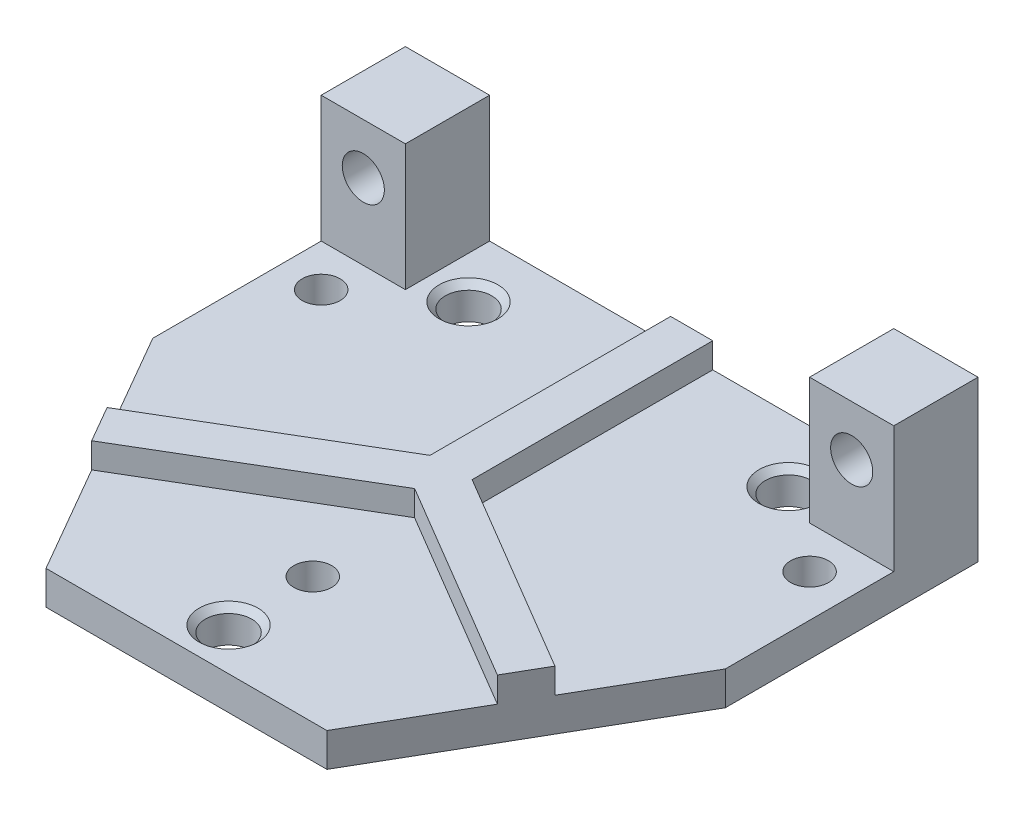
from build123d import *

# Parameters (mm, degrees)
SKETCH1_R           = 2.75
SKETCH1_R_2         = 2.25
BOSS_EXTRUDE1_DEPTH = 4
BOSS_EXTRUDE2_DEPTH = 3
SKETCH3_W           = 10
SKETCH3_H           = 10
BOSS_EXTRUDE3_DEPTH = 15
SKETCH4_R           = 2.5
CUT_EXTRUDE1_DEPTH  = 72.533209071
CHAMFER1_SIZE       = 0.75


with BuildPart() as part:
    # Sketch1 → Boss-Extrude1 (new body)
    with BuildSketch(Plane(origin=(0, 0, 0), x_dir=(1, 0, 0), z_dir=(0, 1, 0))):
        Polygon((-16.679491924, -30), (16.679491924, -30), (34, 0), (34, 30), (-34, 30), (-34, 0), align=None)
        with Locations(Location((-19, 22.5, 0), (0, 0, 270))):
            Circle(SKETCH1_R, mode=Mode.SUBTRACT)
        with Locations(Location((19, 22.5, 0), (0, 0, 270))):
            Circle(SKETCH1_R, mode=Mode.SUBTRACT)
        with Locations(Location((0, -25, 0), (0, 0, 270))):
            Circle(SKETCH1_R, mode=Mode.SUBTRACT)
        with Locations(Location((-29, 15, 0), (0, 0, 270))):
            Circle(SKETCH1_R_2, mode=Mode.SUBTRACT)
        with Locations(Location((29, 15, 0), (0, 0, 270))):
            Circle(SKETCH1_R_2, mode=Mode.SUBTRACT)
        with Locations(Location((0, -15, 0), (0, 0, 270))):
            Circle(SKETCH1_R_2, mode=Mode.SUBTRACT)
    extrude(amount=BOSS_EXTRUDE1_DEPTH)

    # Sketch2 → Boss-Extrude2 (add)
    with BuildSketch(Plane(origin=(0, 4, 0), x_dir=(1, 0, 0), z_dir=(0, 1, 0))):
        Polygon((-26.589820012, -12.834808232), (-24.089671912, -17.165191768), (0, -2.905179879), (24.089671912, -17.165191768), (26.589820012, -12.834808232), (2.5, 1.425291326), (2.5, 30), (-2.5, 30), (-2.5, 1.425291326), align=None)
    extrude(amount=BOSS_EXTRUDE2_DEPTH)

    # Sketch3 → Boss-Extrude3 (add)
    with BuildSketch(Plane(origin=(0, 4, 0), x_dir=(1, 0, 0), z_dir=(0, 1, 0))):
        with Locations((-29, 25)):
            Rectangle(SKETCH3_W, SKETCH3_H)
        with Locations((29, 25)):
            Rectangle(SKETCH3_W, SKETCH3_H)
    extrude(amount=BOSS_EXTRUDE3_DEPTH)

    # Sketch4 → Cut-Extrude1 (cut, through all)
    with BuildSketch(Plane(origin=(0, 0, -30), x_dir=(-1, 0, 0), z_dir=(0, 0, -1))):
        with Locations((-29, 13)):
            Circle(SKETCH4_R)
        with Locations((29, 13)):
            Circle(SKETCH4_R)
    extrude(amount=-CUT_EXTRUDE1_DEPTH, mode=Mode.SUBTRACT)

    # Chamfer1
    chamfer1_edges = [part.edges().sort_by_distance(p)[0] for p in [
        (-19, 4, -25.25),
        (19, 4, -25.25),
        (0, 4, 22.25),
    ]]
    chamfer(chamfer1_edges, length=CHAMFER1_SIZE)


solid = part.part
